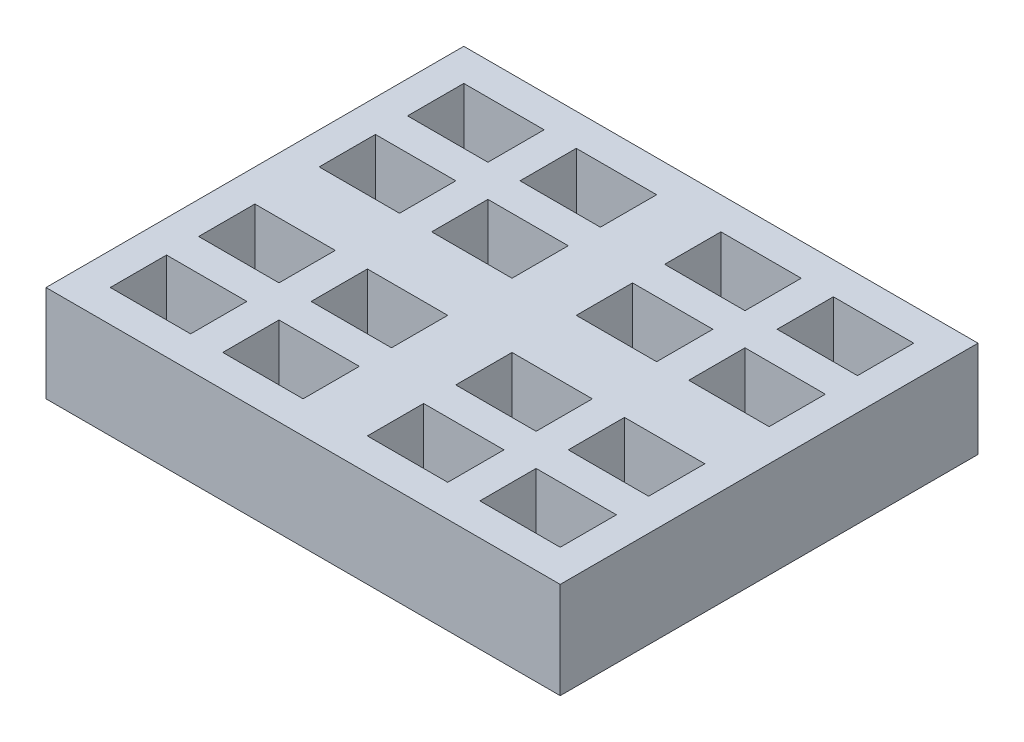
from build123d import *

# Parameters (mm, degrees)
SKETCH1_W           = 16
SKETCH1_H           = 13
SKETCH1_W_2         = 2.5
SKETCH1_H_2         = 1.75
BOSS_EXTRUDE1_DEPTH = 3


with BuildPart() as part:
    # Sketch1 → Boss-Extrude1 (new body)
    with BuildSketch(Plane(origin=(0, 0, 0), x_dir=(1, 0, 0), z_dir=(0, 1, 0))):
        with Locations((-4.357364788, -0.36440678)):
            Rectangle(SKETCH1_W, SKETCH1_H)
        with Locations((-10.107364788, 1.51059322)):
            Rectangle(SKETCH1_W_2, SKETCH1_H_2, mode=Mode.SUBTRACT)
        with Locations((-10.107364788, 4.26059322)):
            Rectangle(SKETCH1_W_2, SKETCH1_H_2, mode=Mode.SUBTRACT)
        with Locations((-6.607364788, 1.51059322)):
            Rectangle(SKETCH1_W_2, SKETCH1_H_2, mode=Mode.SUBTRACT)
        with Locations((-6.607364788, 4.26059322)):
            Rectangle(SKETCH1_W_2, SKETCH1_H_2, mode=Mode.SUBTRACT)
        with Locations((-6.607364788, -2.23940678)):
            Rectangle(SKETCH1_W_2, SKETCH1_H_2, mode=Mode.SUBTRACT)
        with Locations((-10.107364788, -2.23940678)):
            Rectangle(SKETCH1_W_2, SKETCH1_H_2, mode=Mode.SUBTRACT)
        with Locations((-6.607364788, -4.98940678)):
            Rectangle(SKETCH1_W_2, SKETCH1_H_2, mode=Mode.SUBTRACT)
        with Locations((-10.107364788, -4.98940678)):
            Rectangle(SKETCH1_W_2, SKETCH1_H_2, mode=Mode.SUBTRACT)
        with Locations((-2.107364788, -4.98940678)):
            Rectangle(SKETCH1_W_2, SKETCH1_H_2, mode=Mode.SUBTRACT)
        with Locations((1.392635212, -4.98940678)):
            Rectangle(SKETCH1_W_2, SKETCH1_H_2, mode=Mode.SUBTRACT)
        with Locations((-2.107364788, -2.23940678)):
            Rectangle(SKETCH1_W_2, SKETCH1_H_2, mode=Mode.SUBTRACT)
        with Locations((1.392635212, -2.23940678)):
            Rectangle(SKETCH1_W_2, SKETCH1_H_2, mode=Mode.SUBTRACT)
        with Locations((-2.107364788, 1.51059322)):
            Rectangle(SKETCH1_W_2, SKETCH1_H_2, mode=Mode.SUBTRACT)
        with Locations((1.392635212, 1.51059322)):
            Rectangle(SKETCH1_W_2, SKETCH1_H_2, mode=Mode.SUBTRACT)
        with Locations((-2.107364788, 4.26059322)):
            Rectangle(SKETCH1_W_2, SKETCH1_H_2, mode=Mode.SUBTRACT)
        with Locations((1.392635212, 4.26059322)):
            Rectangle(SKETCH1_W_2, SKETCH1_H_2, mode=Mode.SUBTRACT)
    extrude(amount=BOSS_EXTRUDE1_DEPTH)


solid = part.part
